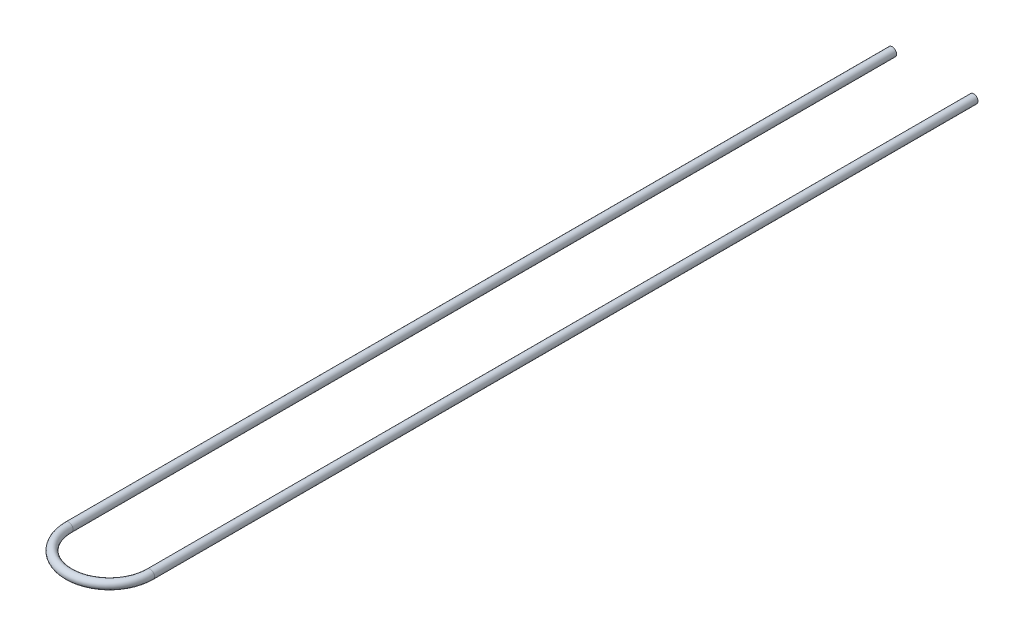
from build123d import *

# Parameters (mm, degrees)
SKETCH2_R   = 11.1
SKETCH2_R_2 = 9.95


with BuildPart() as part:
    # Sweep1: sweep along a path in Sketch1
    with BuildLine(Plane(origin=(0, 0, 0), x_dir=(1, 0, 0), z_dir=(0, 1, 0))) as sweep1_path:
        Line((171.69, -300), (171.69, -2440))
        ThreePointArc((171.69, -2440), (65.845, -2545.845), (-40, -2440))
        Line((-40, -2440), (-40, -300))
    # Sketch2 → Sweep1 (sweep)
    with BuildSketch(Plane(origin=(171.69, 0, 300), x_dir=(-1, 0, 0), z_dir=(0, 0, -1))):
        Circle(SKETCH2_R)
        Circle(SKETCH2_R_2, mode=Mode.SUBTRACT)
    sweep(path=sweep1_path.line)


solid = part.part
